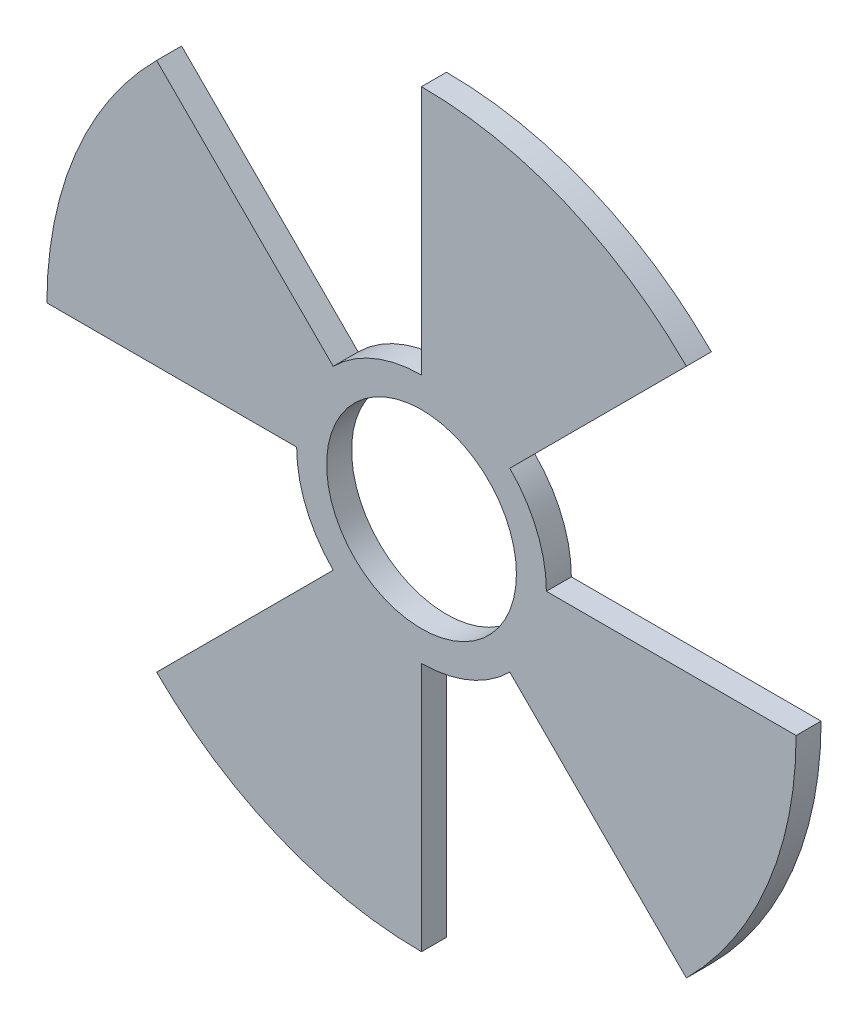
from build123d import *

# Parameters (mm, degrees)
SKETCH_1_R      = 10
SKETCH_1_R_2    = 7.6
EXTRUDE_1_DEPTH = 2
EXTRUDE_START   = -2
EXTRUDE_2_DEPTH = 2


with BuildPart() as part:
    # ｽｹｯﾁ1 → ﾎﾞｽ - 押し出し1 (new body)
    with BuildSketch(Plane.XY):
        Circle(SKETCH_1_R)
        Circle(SKETCH_1_R_2, mode=Mode.SUBTRACT)
    extrude(amount=EXTRUDE_1_DEPTH)

    # ｽｹｯﾁ2 → ﾎﾞｽ - 押し出し2 (add)
    with BuildSketch(Plane.XY.offset(2).offset(EXTRUDE_START)):
        with BuildLine():
            Line((0, 30), (0, 10))
            ThreePointArc((0, 10), (3.826834324, 9.238795325), (7.071067812, 7.071067812))
            Line((7.071067812, 7.071067812), (21.213203436, 21.213203436))
            ThreePointArc((21.213203436, 21.213203436), (11.480502971, 27.716385975), (0, 30))
        make_face()
        with BuildLine():
            Line((21.213203436, -21.213203436), (7.071067812, -7.071067812))
            ThreePointArc((7.071067812, -7.071067812), (9.238795325, -3.826834324), (10, 0))
            Line((10, 0), (30, 0))
            ThreePointArc((30, 0), (27.716385975, -11.480502971), (21.213203436, -21.213203436))
        make_face()
        with BuildLine():
            Line((-21.213203436, -21.213203436), (-7.071067812, -7.071067812))
            ThreePointArc((-7.071067812, -7.071067812), (-3.826834324, -9.238795325), (0, -10))
            Line((0, -10), (0, -30))
            ThreePointArc((0, -30), (-11.480502971, -27.716385975), (-21.213203436, -21.213203436))
        make_face()
        with BuildLine():
            Line((-21.213203436, 21.213203436), (-7.071067812, 7.071067812))
            ThreePointArc((-7.071067812, 7.071067812), (-9.238795325, 3.826834324), (-10, 0))
            Line((-10, 0), (-30, 0))
            ThreePointArc((-30, 0), (-27.716385975, 11.480502971), (-21.213203436, 21.213203436))
        make_face()
    extrude(amount=EXTRUDE_2_DEPTH)


solid = part.part
